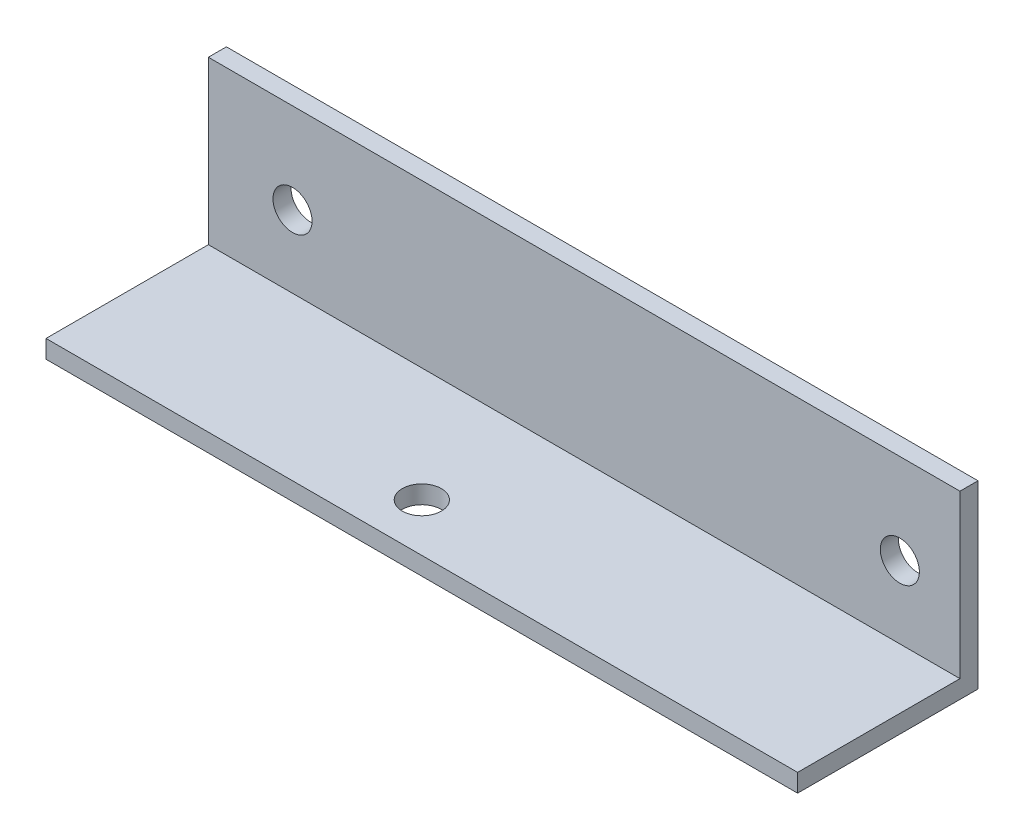
from build123d import *

# Parameters (mm, degrees)
SKETCH1_W                      = 125
SKETCH1_H                      = 30
BOSS_EXTRUDE1_DEPTH            = 3
SKETCH2_W                      = 125
SKETCH2_H                      = 3
BOSS_EXTRUDE2_DEPTH            = 27
F_6_5_6_5_DIAMETER_HOLE1_D     = 6.5
F_6_5_6_5_DIAMETER_HOLE1_DEPTH = 10
F_6_5_6_5_DIAMETER_HOLE1_TIP   = 1.952797012
F_6_5_6_5_DIAMETER_HOLE2_D     = 6.5
F_6_5_6_5_DIAMETER_HOLE2_DEPTH = 10
F_6_5_6_5_DIAMETER_HOLE2_TIP   = 1.952797012


with BuildPart() as part:
    # Sketch1 → Boss-Extrude1 (new body)
    with BuildSketch(Plane.XY):
        Rectangle(SKETCH1_W, SKETCH1_H)
    extrude(amount=BOSS_EXTRUDE1_DEPTH)

    # Sketch2 → Boss-Extrude2 (add)
    with BuildSketch(Plane.XY.offset(3)):
        with Locations((0, -13.5)):
            Rectangle(SKETCH2_W, SKETCH2_H)
    extrude(amount=BOSS_EXTRUDE2_DEPTH)

    # Ø6.5 (6.5) Diameter Hole1
    with Locations(Plane(origin=(0, 0, 0), x_dir=(-1, 0, 0), z_dir=(0, 0, -1))):
        with Locations((48.5, 0), (-52.5, 0)):
            Hole(F_6_5_6_5_DIAMETER_HOLE1_D / 2, depth=F_6_5_6_5_DIAMETER_HOLE1_DEPTH)
            with Locations((0, 0, -(F_6_5_6_5_DIAMETER_HOLE1_DEPTH + F_6_5_6_5_DIAMETER_HOLE1_TIP / 2))):  # 118° drill point
                Cone(0, F_6_5_6_5_DIAMETER_HOLE1_D / 2, F_6_5_6_5_DIAMETER_HOLE1_TIP, mode=Mode.SUBTRACT)

    # Ø6.5 (6.5) Diameter Hole2
    with Locations(Plane(origin=(0, -15, 0), x_dir=(-1, 0, 0), z_dir=(0, -1, 0))):
        with Locations((8.000002921, -22)):
            Hole(F_6_5_6_5_DIAMETER_HOLE2_D / 2, depth=F_6_5_6_5_DIAMETER_HOLE2_DEPTH)
            with Locations((0, 0, -(F_6_5_6_5_DIAMETER_HOLE2_DEPTH + F_6_5_6_5_DIAMETER_HOLE2_TIP / 2))):  # 118° drill point
                Cone(0, F_6_5_6_5_DIAMETER_HOLE2_D / 2, F_6_5_6_5_DIAMETER_HOLE2_TIP, mode=Mode.SUBTRACT)


solid = part.part
